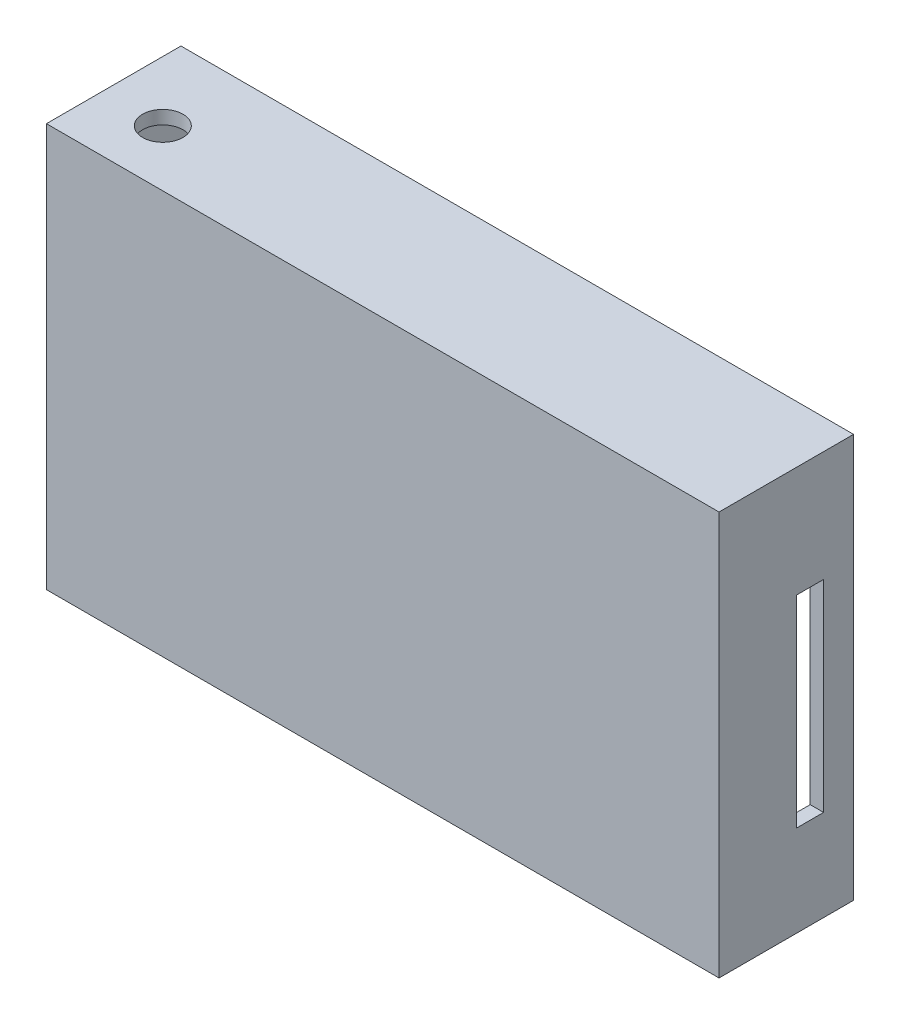
from build123d import *

# Parameters (mm, degrees)
SKETCH1_W           = 50
SKETCH1_H           = 30
BOSS_EXTRUDE1_DEPTH = 10
SHELL4_T            = -1
SKETCH9_W           = 2
SKETCH9_H           = 15
CUT_EXTRUDE5_DEPTH  = 63.649820431
SKETCH10_R          = 1.5
CUT_EXTRUDE6_DEPTH  = 21


with BuildPart() as part:
    # Sketch1 → Boss-Extrude1 (new body)
    with BuildSketch(Plane.XY):
        Rectangle(SKETCH1_W, SKETCH1_H)
    extrude(amount=BOSS_EXTRUDE1_DEPTH)

    # Shell4
    shell4_openings = [part.faces().sort_by_distance(p)[0] for p in [
        (0, 0, 0),
    ]]
    offset(amount=SHELL4_T, openings=shell4_openings, kind=Kind.INTERSECTION)

    # Sketch9 → Cut-Extrude5 (cut, through all)
    with BuildSketch(Plane(origin=(35, 0, 0), x_dir=(0, 0, -1), z_dir=(1, 0, 0))):
        with Locations((-3.225993387, -0.726962262)):
            Rectangle(SKETCH9_W, SKETCH9_H)
    extrude(amount=-CUT_EXTRUDE5_DEPTH, mode=Mode.SUBTRACT)

    # Sketch10 → Cut-Extrude6 (cut)
    with BuildSketch(Plane(origin=(0, 25, 0), x_dir=(1, 0, 0), z_dir=(0, 1, 0))):
        with Locations(Location((-20.534888549, -5.815355869, 0), (0, 0, 90))):
            Circle(SKETCH10_R)
    extrude(amount=-CUT_EXTRUDE6_DEPTH, mode=Mode.SUBTRACT)


solid = part.part
